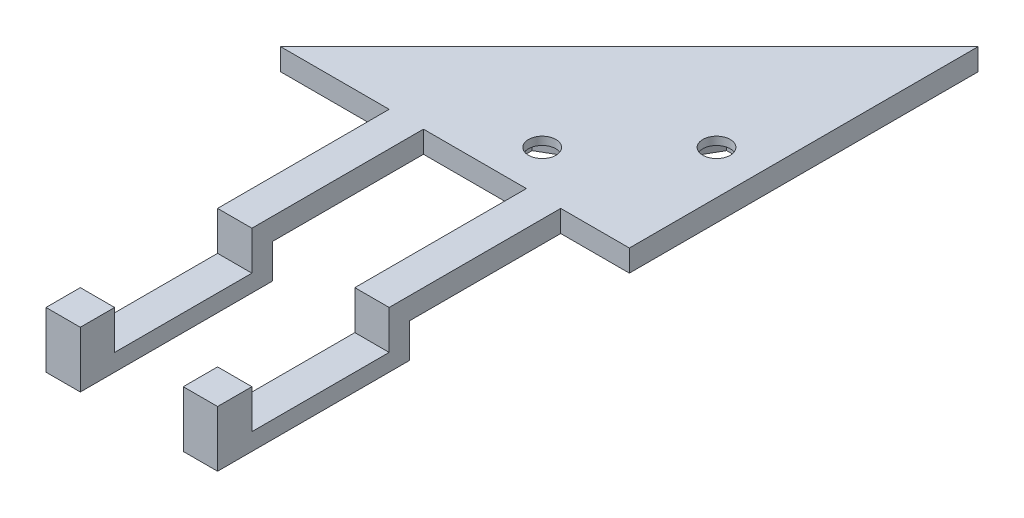
from build123d import *

# Parameters (mm, degrees)
BOSS_EXTRUDE1_DEPTH     = 3.175
SKETCH2_R               = 2
CUT_EXTRUDE1_DEPTH      = 72.912172996
CUT_EXTRUDE2_START      = -3.175
CUT_EXTRUDE2_DEPTH      = 2
BOSS_EXTRUDE2_START     = 10
BOSS_EXTRUDE2_DEPTH     = 5
BOSS_EXTRUDE3_START     = 30
BOSS_EXTRUDE3_DEPTH     = 5
CUT_EXTRUDE3_DEPTH      = 73.015831593
CUT_EXTRUDE3_DEPTH_BACK = 73.015831593
SKETCH6_W               = 50.943951029
SKETCH6_H               = 108.352089197


with BuildPart() as part:
    # Sketch1 → Boss-Extrude1 (new body)
    with BuildSketch(Plane(origin=(0, 0, 0), x_dir=(1, 0, 0), z_dir=(0, 1, 0))):
        Polygon((0, 0), (50.8, 0), (0, 50.8), align=None)
    extrude(amount=BOSS_EXTRUDE1_DEPTH)

    # Sketch2 → Cut-Extrude1 (cut, through all)
    with BuildSketch(Plane(origin=(0, 3.175, 0), x_dir=(1, 0, 0), z_dir=(0, 1, 0))):
        with Locations(Location((19.05, 6.35, 0), (0, 0, 270))):
            Circle(SKETCH2_R)
        with Locations(Location((6.35, 19.05, 0), (0, 0, 90))):
            Circle(SKETCH2_R)
    extrude(amount=-CUT_EXTRUDE1_DEPTH, mode=Mode.SUBTRACT)

    # Sketch3 → Cut-Extrude2 (cut)
    with BuildSketch(Plane(origin=(0, 3.175, 0), x_dir=(1, 0, 0), z_dir=(0, 1, 0)).offset(CUT_EXTRUDE2_START)):
        Polygon((8.370723055, 15.550005), (10.391446111, 19.05), (8.370723055, 22.549995), (4.329276945, 22.549995), (2.308553889, 19.05), (4.329276945, 15.550005), align=None)
        Polygon((22.549995, 4.329276945), (19.05, 2.308553889), (15.550005, 4.329276945), (15.550005, 8.370723055), (19.05, 10.391446111), (22.549995, 8.370723055), align=None)
    extrude(amount=CUT_EXTRUDE2_DEPTH, mode=Mode.SUBTRACT)

    # Sketch5 → Boss-Extrude2 (add)
    with BuildSketch(Plane(origin=(0, 0, 0), x_dir=(0, 0, -1), z_dir=(1, 0, 0)).offset(BOSS_EXTRUDE2_START)):
        Polygon((0, 0), (0, 3.175), (-25, 3.175), (-25, -2.5), (-45, -2.5), (-45, 3.175), (-50, 3.175), (-50, -5), (-22, -5), (-22, 0), align=None)
    extrude(amount=BOSS_EXTRUDE2_DEPTH)

    # Sketch5<3> → Boss-Extrude3 (add)
    with BuildSketch(Plane(origin=(0, 0, 0), x_dir=(0, 0, -1), z_dir=(1, 0, 0)).offset(BOSS_EXTRUDE3_START)):
        Polygon((0, 0), (0, 3.175), (-25, 3.175), (-25, -2.5), (-45, -2.5), (-45, 3.175), (-50, 3.175), (-50, -5), (-22, -5), (-22, 0), align=None)
    extrude(amount=BOSS_EXTRUDE3_DEPTH)

    # Mirror1: part across plane


with BuildPart() as part_1:
    add(part.part)
    add(part.part.mirror(Plane(origin=(0, 0, 0), x_dir=(0, 0, 1), z_dir=(1, 0, 0))))

    # Sketch6 → Cut-Extrude3 (cut, two sides: drawn at the far end of the back side and taken through both)
    with BuildSketch(Plane(origin=(0, 0, 0), x_dir=(1, 0, 0), z_dir=(0, 1, 0)).offset(-CUT_EXTRUDE3_DEPTH_BACK)):
        with Locations((25.471975515, -0.138682261)):
            Rectangle(SKETCH6_W, SKETCH6_H)
    extrude(amount=CUT_EXTRUDE3_DEPTH + CUT_EXTRUDE3_DEPTH_BACK, mode=Mode.SUBTRACT)


solid = part_1.part
